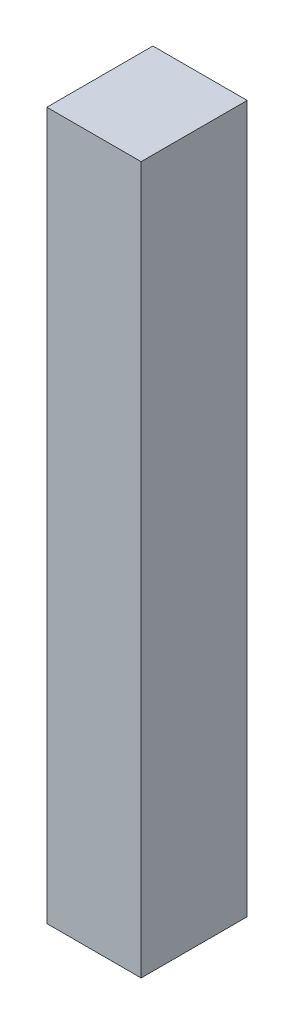
from build123d import *

# Parameters (mm, degrees)
SKETCH1_W           = 40
SKETCH1_H           = 45
BOSS_EXTRUDE1_DEPTH = 300


with BuildPart() as part:
    # Sketch1 → Boss-Extrude1 (new body)
    with BuildSketch(Plane(origin=(0, 0, 0), x_dir=(1, 0, 0), z_dir=(0, 1, 0))):
        Rectangle(SKETCH1_W, SKETCH1_H)
    extrude(amount=BOSS_EXTRUDE1_DEPTH)


solid = part.part
